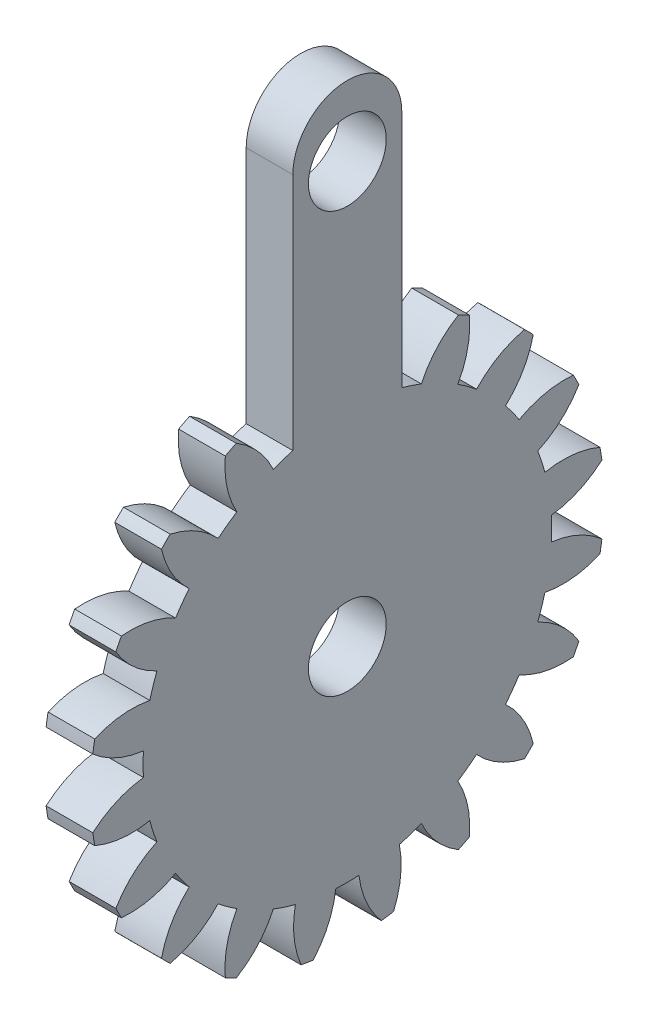
from build123d import *

# Parameters (mm, degrees)
BASPROSKE_W         = 3
BASPROSKE_H         = 16.5
TOOTHCUT_DEPTH      = 24.526580712
TEETHCUTS_COUNT     = 20
TEETHCUTS_ANGLE     = 342
EXTRUDE_3_DEPTH     = 3
SKETCH_3_R          = 2.5
CUT_EXTRUDE_2_DEPTH = 36.618883333


with BuildPart() as part:
    # BasProSke → Base-Revolve (revolve)
    with BuildSketch(Plane(origin=(0, 0, 0), x_dir=(1, 0, 0), z_dir=(0, 1, 0)), mode=Mode.PRIVATE) as base_revolve_sk:
        with Locations((1.5, 8.25)):
            Rectangle(BASPROSKE_W, BASPROSKE_H)
    revolve(base_revolve_sk.sketch.rotate(Axis((-10, 0, 0), (1, 0, 0)), 180), axis=Axis((-10, 0, 0), (1, 0, 0)))

    # TooCutSke → ToothCut (cut, through all)
    with BuildSketch(Plane(origin=(0, 0, 0), x_dir=(0, 0, -1), z_dir=(1, 0, 0))):
        with BuildLine():
            ThreePointArc((0.74381438, 13.102904875), (0, 13.124), (-0.74381438, 13.102904875))
            ThreePointArc((-0.74381438, 13.102904875), (-1.226473103, 14.852072512), (-2.209965745, 16.376962373))
            ThreePointArc((-2.209965745, 16.376962373), (0, 16.5254), (2.209965745, 16.376962373))
            ThreePointArc((2.209965745, 16.376962373), (1.226473103, 14.852072512), (0.74381438, 13.102904875))
        make_face()
    toothcut = extrude(amount=TOOTHCUT_DEPTH, mode=Mode.SUBTRACT)

    # TeethCuts: ToothCut ×20 about axis
    teethcuts_axis = Axis((-10, 0, 0), (1, 0, 0))
    for i in range(1, TEETHCUTS_COUNT):
        add(toothcut.rotate(teethcuts_axis, i * TEETHCUTS_ANGLE / (TEETHCUTS_COUNT - 1)), mode=Mode.SUBTRACT)

    # 草图2 → 凸台-拉伸3 (add)
    with BuildSketch(Plane.ZY):
        with BuildLine():
            Line((-3.5, 0), (-3.5, 28))
            ThreePointArc((-3.5, 28), (0, 31.5), (3.5, 28))
            Line((3.5, 28), (3.5, 0))
            ThreePointArc((3.5, 0), (0, -3.5), (-3.5, 0))
        make_face()
    extrude(amount=-EXTRUDE_3_DEPTH)

    # 草图3 → 切除-拉伸2 (cut, through all)
    with BuildSketch(Plane.ZY):
        Circle(SKETCH_3_R)
        with Locations((0, 27)):
            Circle(SKETCH_3_R)
    extrude(amount=-CUT_EXTRUDE_2_DEPTH, mode=Mode.SUBTRACT)


solid = part.part
